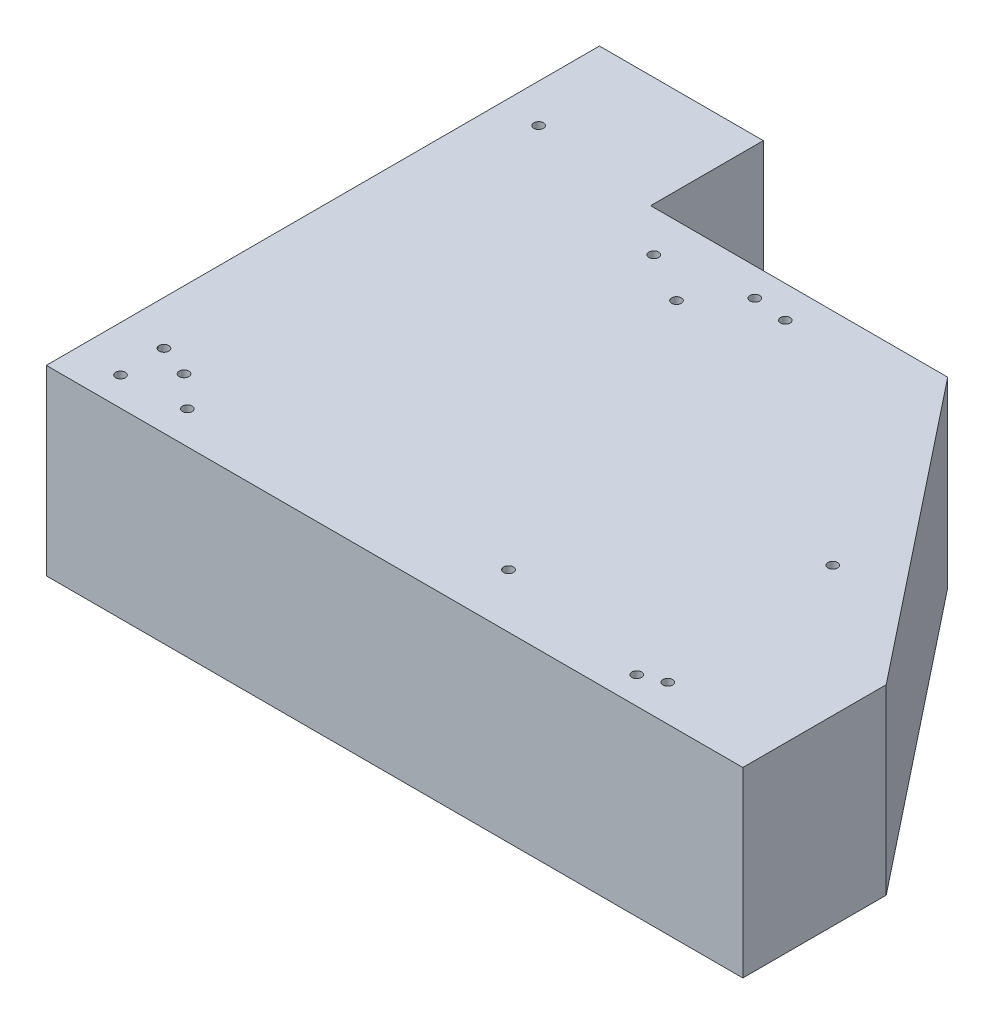
from build123d import *

# Parameters (mm, degrees)
ALUMINUM_BLOCK_DEPTH = 113.03
A_ARM_SKETCHES_R     = 3
A_ARM_HOLES_DEPTH    = 20


with BuildPart() as part:
    # Sketch1 → ALUMINUM BLOCK (new body)
    with BuildSketch(Plane(origin=(0, 0, 0), x_dir=(1, 0, 0), z_dir=(0, 1, 0))):
        Polygon((-187.5, -135.642424533), (244.3, -135.642424533), (244.3, -46.742424533), (98.25, 137.407575467), (-85.9, 137.407575467), (-85.9, 207.257575467), (-187.5, 207.257575467), align=None)
    extrude(amount=ALUMINUM_BLOCK_DEPTH)

    # A-ARM SKETCHES → A-ARM HOLES (cut)
    with BuildSketch(Plane(origin=(0, 113.03, 0), x_dir=(1, 0, 0), z_dir=(0, 1, 0))):
        with Locations(Location((-163.609115423, 145.695818662, 0), (0, 0, 270))):
            Circle(A_ARM_SKETCHES_R)
        with Locations(Location((-3.898882545, 120.015251172, 0), (0, 0, 270))):
            Circle(A_ARM_SKETCHES_R)
        with Locations(Location((175.311223127, -113.149569553, 0), (0, 0, 270))):
            Circle(A_ARM_SKETCHES_R)
        with Locations(Location((-160.15888427, -90.036396379, 0), (0, 0, 270))):
            Circle(A_ARM_SKETCHES_R)
        with Locations(Location((-159.322465718, -117.822298669, 0), (0, 0, 270))):
            Circle(A_ARM_SKETCHES_R)
        with Locations(Location((-120.450372331, -115.251672549, 0), (0, 0, 270))):
            Circle(A_ARM_SKETCHES_R)
        with Locations(Location((-58.544962433, 112.036813196, 0), (0, 0, 270))):
            Circle(A_ARM_SKETCHES_R)
        with Locations(Location((65.478811369, -102.10088587, 0), (0, 0, 270))):
            Circle(A_ARM_SKETCHES_R)
        with Locations(Location((163.603739253, 0.788099457, 0), (0, 0, 270))):
            Circle(A_ARM_SKETCHES_R)
        with Locations(Location((161.606684995, -118.729685562, 0), (0, 0, 270))):
            Circle(A_ARM_SKETCHES_R)
        with Locations(Location((-140.251816154, -97.517207608, 0), (0, 0, 270))):
            Circle(A_ARM_SKETCHES_R)
        with Locations(Location((17.394243717, 117.626925231, 0), (0, 0, 270))):
            Circle(A_ARM_SKETCHES_R)
        with Locations(Location((-26.908089244, 94.447121648, 0), (0, 0, 270))):
            Circle(A_ARM_SKETCHES_R)
    extrude(amount=-A_ARM_HOLES_DEPTH, mode=Mode.SUBTRACT)


solid = part.part
